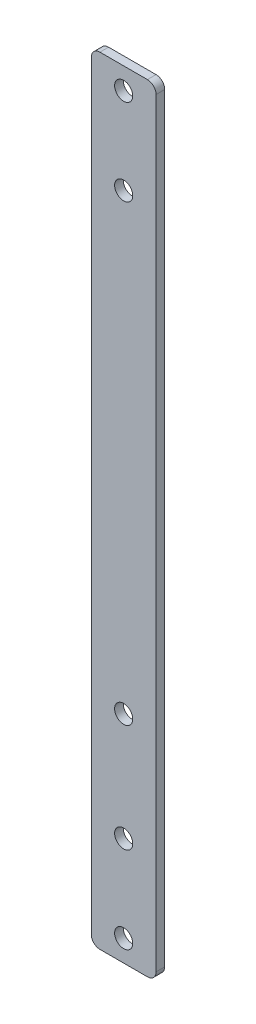
from build123d import *

# Parameters (mm, degrees)
SKETCH_1_R          = 2.1
EXTRUDE_1_DEPTH     = 2
SKETCH_3_R          = 2.1
CUT_EXTRUDE_2_DEPTH = 10


with BuildPart() as part:
    # Эскиз1 → Бобышка-Вытянуть1 (new body)
    with BuildSketch(Plane.XY):
        with BuildLine():
            Line((-7.5, 173), (-7.5, -3))
            ThreePointArc((-7.5, -3), (-6.914213562, -4.414213562), (-5.5, -5))
            Line((-5.5, -5), (5.5, -5))
            ThreePointArc((5.5, -5), (6.914213562, -4.414213562), (7.5, -3))
            Line((7.5, -3), (7.5, 173))
            ThreePointArc((7.5, 173), (6.914213562, 174.414213562), (5.5, 175))
            Line((5.5, 175), (-5.5, 175))
            ThreePointArc((-5.5, 175), (-6.914213562, 174.414213562), (-7.5, 173))
        make_face()
        with Locations((0, 170)):
            Circle(SKETCH_1_R, mode=Mode.SUBTRACT)
        with Locations((0, 150)):
            Circle(SKETCH_1_R, mode=Mode.SUBTRACT)
        with Locations((0, 20)):
            Circle(SKETCH_1_R, mode=Mode.SUBTRACT)
        Circle(SKETCH_1_R, mode=Mode.SUBTRACT)
    extrude(amount=EXTRUDE_1_DEPTH)

    # Эскиз3 → Вырез-Вытянуть2 (cut)
    with BuildSketch(Plane.XY.offset(2)):
        with Locations((0, 45)):
            Circle(SKETCH_3_R)
    extrude(amount=-CUT_EXTRUDE_2_DEPTH, mode=Mode.SUBTRACT)


solid = part.part
